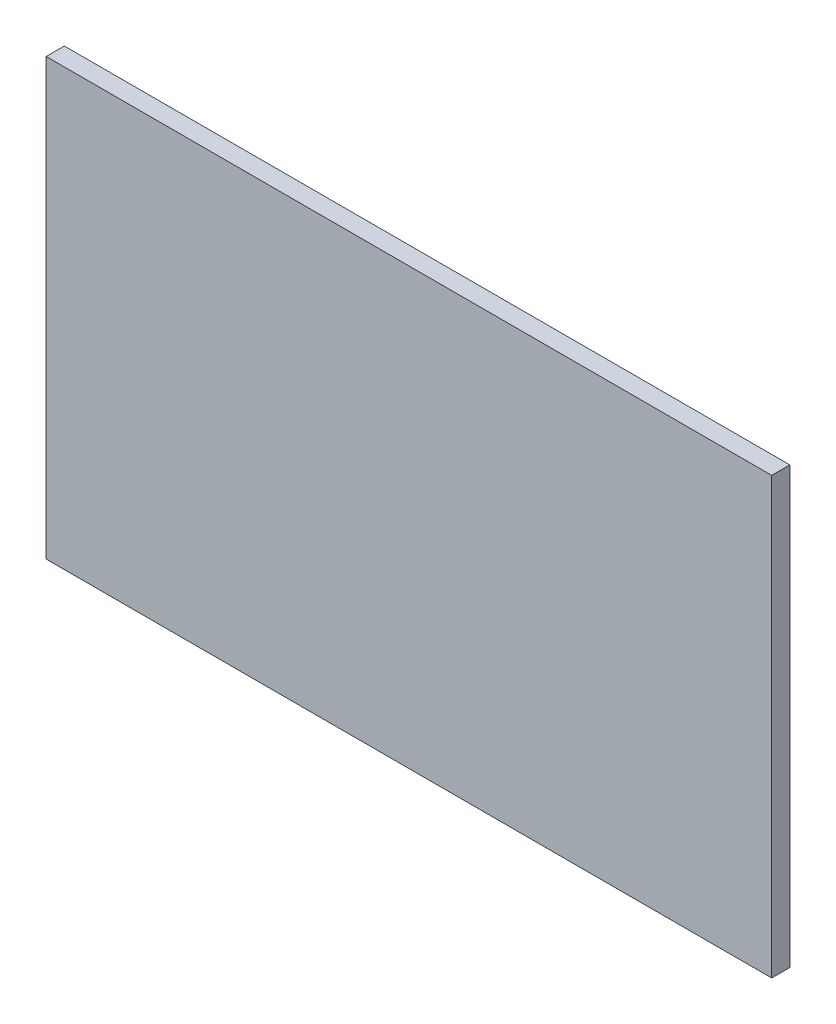
from build123d import *

# Parameters (mm, degrees)
SKETCH1_W           = 508
SKETCH1_H           = 304.8
BOSS_EXTRUDE1_DEPTH = 12.7


with BuildPart() as part:
    # Sketch1 → Boss-Extrude1 (new body)
    with BuildSketch(Plane.XY):
        Rectangle(SKETCH1_W, SKETCH1_H)
    extrude(amount=BOSS_EXTRUDE1_DEPTH)


solid = part.part
